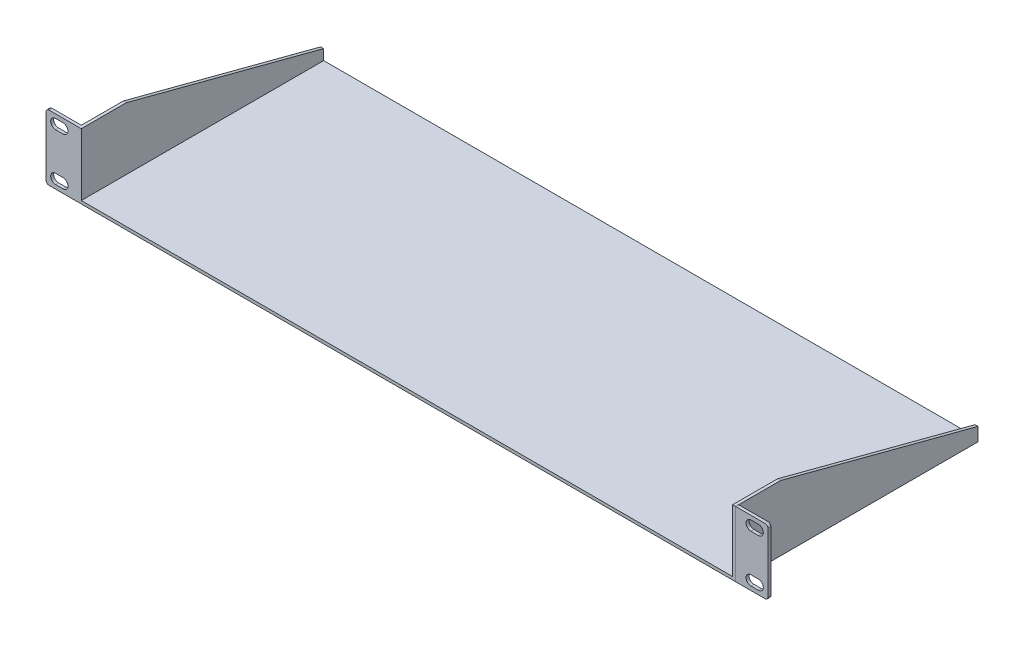
from build123d import *

# Parameters (mm, degrees)
BOSS_EXTRUDE1_DEPTH     = 2
BOSS_EXTRUDE1_2_DEPTH   = 2
CUT_EXTRUDE4_DEPTH      = 465.530162852
CUT_EXTRUDE4_DEPTH_BACK = 2
BOSS_EXTRUDE2_DEPTH     = 162
CUT_EXTRUDE5_DEPTH      = 517


with BuildPart() as part:
    # Sketch2 → Boss-Extrude1 (new body)
    with BuildSketch(Plane.XY):
        with BuildLine():
            Line((-19.761146461, 37.553354522), (-19.761146461, -2.046645478))
            ThreePointArc((-19.761146461, -2.046645478), (-19.175360023, -3.46085904), (-17.761146461, -4.046645478))
            Line((-17.761146461, -4.046645478), (1.838853539, -4.046645478))
            Line((1.838853539, -4.046645478), (1.838853539, -2.446645478))
            Line((1.838853539, -2.446645478), (1.838853539, 37.953354522))
            Line((1.838853539, 37.953354522), (1.838853539, 39.553354522))
            Line((1.838853539, 39.553354522), (-17.761146461, 39.553354522))
            ThreePointArc((-17.761146461, 39.553354522), (-19.175360023, 38.967568085), (-19.761146461, 37.553354522))
        make_face()
    extrude(amount=BOSS_EXTRUDE1_DEPTH)


with BuildPart() as body_2:
    # Sketch2 → Boss-Extrude1 2 (new body)
    with BuildSketch(Plane.XY):
        with BuildLine():
            Line((441.238853539, -2.446645478), (441.238853539, -4.046645478))
            Line((441.238853539, -4.046645478), (460.838853539, -4.046645478))
            ThreePointArc((460.838853539, -4.046645478), (462.253067101, -3.46085904), (462.838853539, -2.046645478))
            Line((462.838853539, -2.046645478), (462.838853539, 37.553354522))
            ThreePointArc((462.838853539, 37.553354522), (462.253067101, 38.967568085), (460.838853539, 39.553354522))
            Line((460.838853539, 39.553354522), (441.238853539, 39.553354522))
            Line((441.238853539, 39.553354522), (441.238853539, 37.953354522))
            Line((441.238853539, 37.953354522), (441.238853539, -2.446645478))
        make_face()
    extrude(amount=BOSS_EXTRUDE1_2_DEPTH)


with BuildPart() as cut_extrude4_tool:
    # Sketch3 → Cut-Extrude4 (new, two sides: drawn at the far end of the back side and taken through both)
    with BuildSketch(Plane.XY.offset(-CUT_EXTRUDE4_DEPTH_BACK)):
        with BuildLine():
            Line((-8.361146461, -1.376645478), (-13.361146461, -1.376645478))
            ThreePointArc((-13.361146461, -1.376645478), (-16.611146461, 1.873354522), (-13.361146461, 5.123354522))
            Line((-13.361146461, 5.123354522), (-8.361146461, 5.123354522))
            ThreePointArc((-8.361146461, 5.123354522), (-5.111146461, 1.873354522), (-8.361146461, -1.376645478))
        make_face()
        with BuildLine():
            Line((-8.361146461, 30.373354522), (-13.361146461, 30.373354522))
            ThreePointArc((-13.361146461, 30.373354522), (-16.611146461, 33.623354522), (-13.361146461, 36.873354522))
            Line((-13.361146461, 36.873354522), (-8.361146461, 36.873354522))
            ThreePointArc((-8.361146461, 36.873354522), (-5.111146461, 33.623354522), (-8.361146461, 30.373354522))
        make_face()
        with BuildLine():
            Line((456.438853539, -1.376645478), (451.438853539, -1.376645478))
            ThreePointArc((451.438853539, -1.376645478), (448.188853539, 1.873354522), (451.438853539, 5.123354522))
            Line((451.438853539, 5.123354522), (456.438853539, 5.123354522))
            ThreePointArc((456.438853539, 5.123354522), (459.688853539, 1.873354522), (456.438853539, -1.376645478))
        make_face()
        with BuildLine():
            Line((456.438853539, 30.373354522), (451.438853539, 30.373354522))
            ThreePointArc((451.438853539, 30.373354522), (448.188853539, 33.623354522), (451.438853539, 36.873354522))
            Line((451.438853539, 36.873354522), (456.438853539, 36.873354522))
            ThreePointArc((456.438853539, 36.873354522), (459.688853539, 33.623354522), (456.438853539, 30.373354522))
        make_face()
    extrude(amount=CUT_EXTRUDE4_DEPTH + CUT_EXTRUDE4_DEPTH_BACK)


with BuildPart() as part_1:
    add(part.part)

    # Cut-Extrude4: cut by cut_extrude4_tool
    add(cut_extrude4_tool.part, mode=Mode.SUBTRACT)

    # Sketch4 → Boss-Extrude2 (add)
    with BuildSketch(Plane.XY.offset(2)):
        Polygon((439.205636074, 39.553354522), (441.205636074, 39.553354522), (441.205636074, -4.046645478), (1.838853539, -4.046645478), (1.838853539, 39.553354522), (3.838853539, 39.553354522), (3.838853539, -2.046645478), (439.205636074, -2.046645478), align=None)
    extrude(amount=-BOSS_EXTRUDE2_DEPTH)

    # Sketch5 → Cut-Extrude5 (cut)
    with BuildSketch(Plane.ZY.offset(-1.838853539)):
        Polygon((-160, 4.907474546), (-28.02547798, 39.553354522), (-160, 39.553354522), align=None)
    extrude(amount=-CUT_EXTRUDE5_DEPTH, mode=Mode.SUBTRACT)


with BuildPart() as body_2_1:
    add(body_2.part)

    # Cut-Extrude4: cut by cut_extrude4_tool
    add(cut_extrude4_tool.part, mode=Mode.SUBTRACT)


solid = Compound([part_1.part, body_2_1.part])
